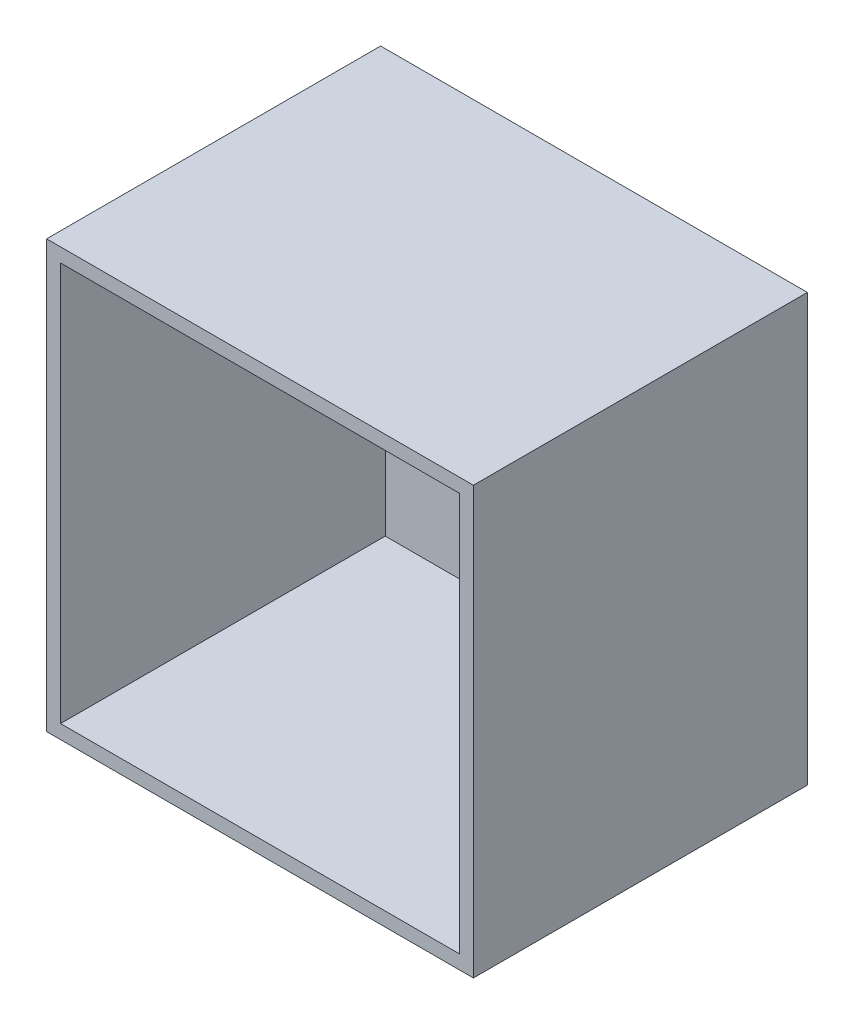
from build123d import *

# Parameters (mm, degrees)
ESQUISSE1_W             = 46
ESQUISSE1_H             = 46
BOSS_EXTRU_1_DEPTH      = 36
ESQUISSE2_W             = 43
ESQUISSE2_H             = 43
ENL_V_MAT_EXTRU_1_DEPTH = 35
ESQUISSE3_R             = 10
ENL_V_MAT_EXTRU_2_DEPTH = 35


with BuildPart() as part:
    # Esquisse1 → Boss.-Extru.1 (new body)
    with BuildSketch(Plane.XY):
        Rectangle(ESQUISSE1_W, ESQUISSE1_H)
    extrude(amount=BOSS_EXTRU_1_DEPTH)

    # Esquisse2 → Enlèv. mat.-Extru.1 (cut)
    with BuildSketch(Plane.XY.offset(36)):
        Rectangle(ESQUISSE2_W, ESQUISSE2_H)
    extrude(amount=-ENL_V_MAT_EXTRU_1_DEPTH, mode=Mode.SUBTRACT)

    # Esquisse3 → Enlèv. mat.-Extru.2 (cut)
    with BuildSketch(Plane(origin=(0, 0, 0), x_dir=(-1, 0, 0), z_dir=(0, 0, -1))):
        Circle(ESQUISSE3_R)
    extrude(amount=-ENL_V_MAT_EXTRU_2_DEPTH, mode=Mode.SUBTRACT)


solid = part.part
